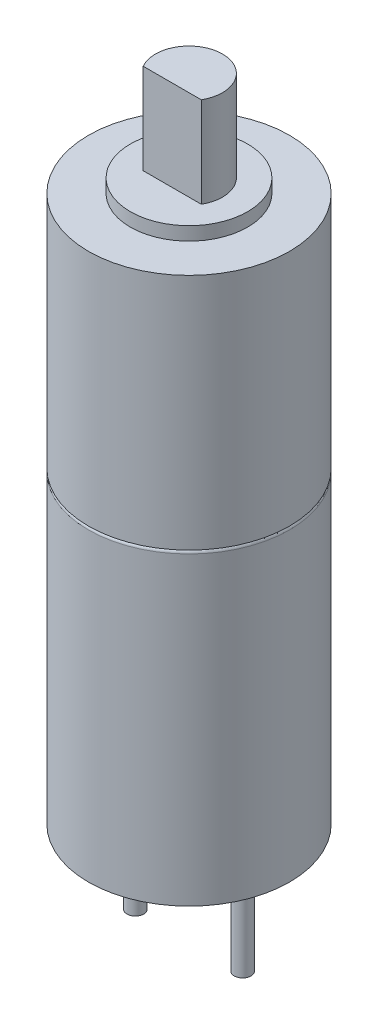
from build123d import *

# Parameters (mm, degrees)
SKETCH1_R           = 3
BOSS_EXTRUDE1_DEPTH = 9.2
FILLET1_R           = 0.1
SKETCH4_R           = 3
BOSS_EXTRUDE4_DEPTH = 7.1
SKETCH6_R           = 1.75
BOSS_EXTRUDE6_DEPTH = 0.4
BOSS_EXTRUDE5_DEPTH = 3.1
SKETCH7_R           = 0.25
BOSS_EXTRUDE7_DEPTH = 3


with BuildPart() as part:
    # Sketch1 → Boss-Extrude1 (new body)
    with BuildSketch(Plane(origin=(0, 0, 0), x_dir=(1, 0, 0), z_dir=(0, 1, 0))):
        with Locations(Location((0, 0, 0), (0, 0, 270))):
            Circle(SKETCH1_R)
    extrude(amount=BOSS_EXTRUDE1_DEPTH)

    # Fillet1
    fillet1_edges = [part.edges().sort_by_distance(p)[0] for p in [
        (0, 9.2, -3),
    ]]
    fillet(fillet1_edges, radius=FILLET1_R)

    # Sketch4 → Boss-Extrude4 (add)
    with BuildSketch(Plane(origin=(0, 9.2, 0), x_dir=(1, 0, 0), z_dir=(0, 1, 0))):
        with Locations(Location((0, 0, 0), (0, 0, 270))):
            Circle(SKETCH4_R)
    extrude(amount=BOSS_EXTRUDE4_DEPTH)

    # Sketch6 → Boss-Extrude6 (add)
    with BuildSketch(Plane(origin=(0, 16.3, 0), x_dir=(1, 0, 0), z_dir=(0, 1, 0))):
        with Locations(Location((0, 0, 0), (0, 0, 270))):
            Circle(SKETCH6_R)
    extrude(amount=BOSS_EXTRUDE6_DEPTH)

    # Sketch5 → Boss-Extrude5 (add)
    with BuildSketch(Plane(origin=(0, 16.3, 0), x_dir=(1, 0, 0), z_dir=(0, 1, 0))):
        with BuildLine():
            Line((-0.866025404, -0.5), (0, -0.5))
            Line((0, -0.5), (0.866025404, -0.5))
            ThreePointArc((0.866025404, -0.5), (0, 1), (-0.866025404, -0.5))
        make_face()
    extrude(amount=BOSS_EXTRUDE5_DEPTH)

    # Sketch7 → Boss-Extrude7 (add)
    with BuildSketch(Plane.XZ):
        with Locations(Location((-1.6, 0, 0), (0, 0, 90))):
            Circle(SKETCH7_R)
        with Locations(Location((1.6, 0, 0), (0, 0, 90))):
            Circle(SKETCH7_R)
    extrude(amount=BOSS_EXTRUDE7_DEPTH)


solid = part.part
